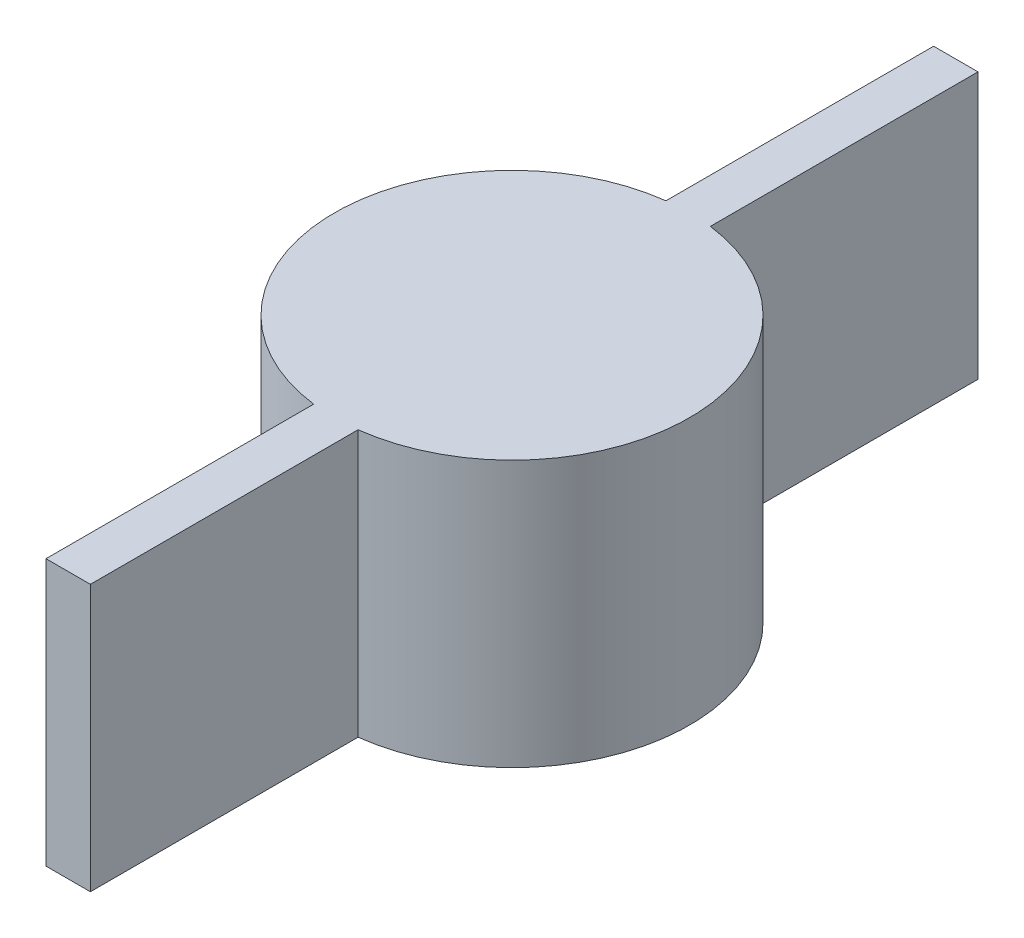
from build123d import *

# Parameters (mm, degrees)
EXTRUDE_1_DEPTH = 30


with BuildPart() as part:
    # 草图1 → 凸台-拉伸1 (new body)
    with BuildSketch(Plane(origin=(0, 0, 0), x_dir=(1, 0, 0), z_dir=(0, 1, 0))):
        with BuildLine():
            Line((-2.5, 50), (-2.5, 19.843134833))
            ThreePointArc((-2.5, 19.843134833), (-20, 0), (-2.5, -19.843134833))
            Line((-2.5, -19.843134833), (-2.5, -50))
            Line((-2.5, -50), (2.5, -50))
            Line((2.5, -50), (2.5, -19.843134833))
            ThreePointArc((2.5, -19.843134833), (20, 0), (2.5, 19.843134833))
            Line((2.5, 19.843134833), (2.5, 50))
            Line((2.5, 50), (-2.5, 50))
        make_face()
    extrude(amount=EXTRUDE_1_DEPTH)


solid = part.part
